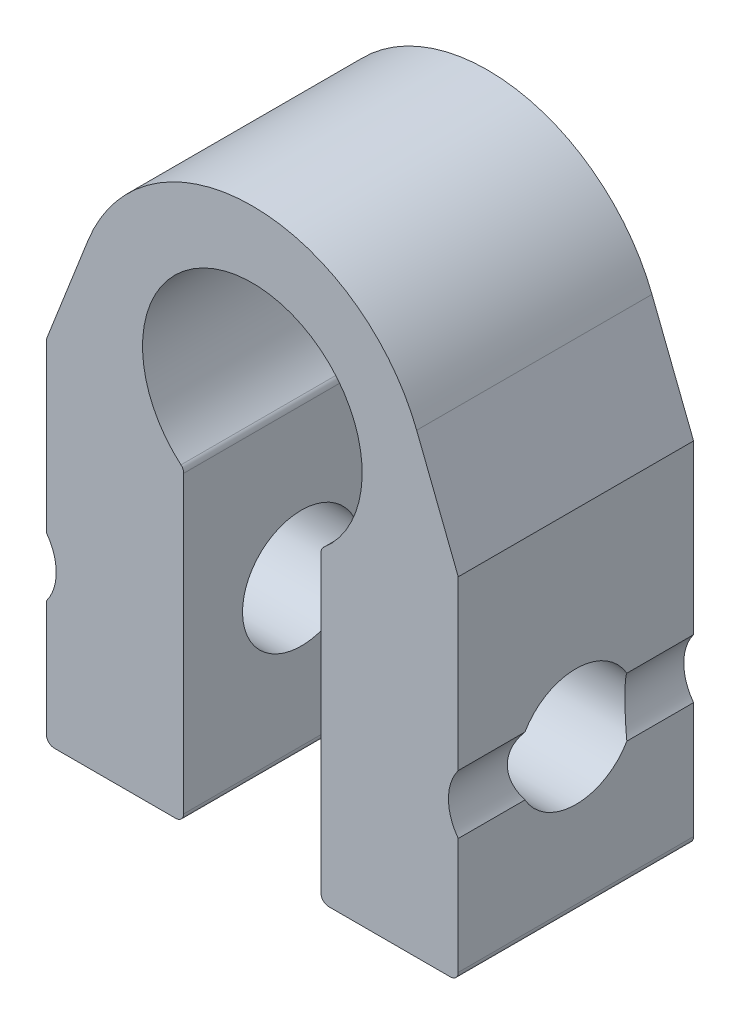
from build123d import *

# Parameters (mm, degrees)
EXTRUDE_1_DEPTH     = 6
CUT_EXTRUDE_1_DEPTH = 13.789155562
SKETCH_3_R          = 1.5
CUT_EXTRUDE_3_DEPTH = 16.692354826
FILLET_1_R          = 0.2


with BuildPart() as part:
    # ｽｹｯﾁ1 → ﾎﾞｽ - 押し出し1 (new body)
    with BuildSketch(Plane.XY):
        with BuildLine():
            Line((-5.25, -10), (-5.25, -1.064783644))
            Line((-5.25, -1.064783644), (-4.190017635, 1.641265431))
            ThreePointArc((-4.190017635, 1.641265431), (0, 4.5), (4.190017635, 1.641265431))
            Line((4.190017635, 1.641265431), (5.25, -1.064783644))
            Line((5.25, -1.064783644), (5.25, -10))
            Line((5.25, -10), (1.75, -10))
            Line((1.75, -10), (1.75, -2.185749299))
            ThreePointArc((1.75, -2.185749299), (0, 2.8), (-1.75, -2.185749299))
            Line((-1.75, -2.185749299), (-1.75, -10))
            Line((-1.75, -10), (-5.25, -10))
        make_face()
    extrude(amount=EXTRUDE_1_DEPTH)

    # ｽｹｯﾁ2 → ｶｯﾄ - 押し出し1 (cut, through all)
    with BuildSketch(Plane.XY.offset(6)):
        with BuildLine():
            Line((-5.25, -6.84287465), (-5.25, -5.34287465))
            ThreePointArc((-5.25, -5.34287465), (-5, -6.09287465), (-5.25, -6.84287465))
        make_face()
        with BuildLine():
            Line((5.25, -6.84287465), (5.25, -5.34287465))
            ThreePointArc((5.25, -5.34287465), (5, -6.09287465), (5.25, -6.84287465))
        make_face()
    extrude(amount=-CUT_EXTRUDE_1_DEPTH, mode=Mode.SUBTRACT)

    # ｽｹｯﾁ3 → ｶｯﾄ - 押し出し3 (cut, through all)
    with BuildSketch(Plane.ZY.offset(5.25)):
        with Locations(Location((3, -6.09287465, 0), (0, 0, 330))):
            Circle(SKETCH_3_R)
    extrude(amount=-CUT_EXTRUDE_3_DEPTH, mode=Mode.SUBTRACT)

    # ﾌｨﾚｯﾄ1
    fillet_1_edges = [part.edges().sort_by_distance(p)[0] for p in [
        (1.75, -2.185749299, 3),
        (-1.75, -2.185749299, 3),
        (-1.75, -10, 3),
        (-5.25, -10, 3),
        (5.25, -10, 3),
        (1.75, -10, 3),
    ]]
    fillet(fillet_1_edges, radius=FILLET_1_R)


solid = part.part
